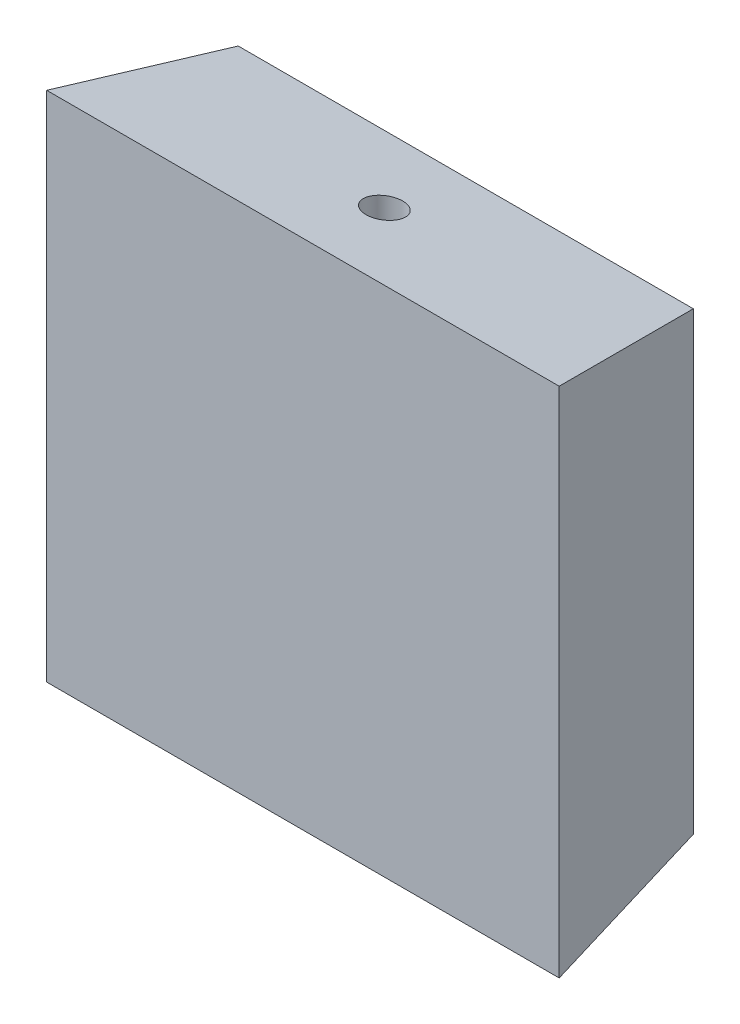
from build123d import *

# Parameters (mm, degrees)
ESQUISSE1_W             = 41.402
ESQUISSE1_H             = 41.402
BOSS_EXTRU_1_DEPTH      = 14.81582
BOSS_EXTRU_1_DRAFT      = -10
ESQUISSE2_R             = 1.666875
ENL_V_MAT_EXTRU_1_DEPTH = 12.7


with BuildPart() as part:
    # Esquisse1 → Boss.-Extru.1 (with draft: the straight prism first)
    with BuildSketch(Plane.XY):
        Rectangle(ESQUISSE1_W, ESQUISSE1_H)
    extrude(amount=BOSS_EXTRU_1_DEPTH)
    # Boss.-Extru.1: the draft: its side faces are tilted about the plane it starts from
    boss_extru_1_sides = [part.faces().sort_by_distance(p)[0] for p in [
        (0, -20.701, 7.40791),
        (20.701, 0, 7.40791),
        (0, 20.701, 7.40791),
        (-20.701, 0, 7.40791),
    ]]
    draft(boss_extru_1_sides, Plane.XY, BOSS_EXTRU_1_DRAFT)

    # Esquisse2 → Enlèv. mat.-Extru.1 (cut)
    with BuildSketch(Plane(origin=(0, 25.4, 0), x_dir=(1, 0, 0), z_dir=(0, 1, 0))):
        with Locations(Location((0, -7.40791, 0), (0, 0, 270))):
            Circle(ESQUISSE2_R)
    extrude(amount=-ENL_V_MAT_EXTRU_1_DEPTH, mode=Mode.SUBTRACT)


solid = part.part
